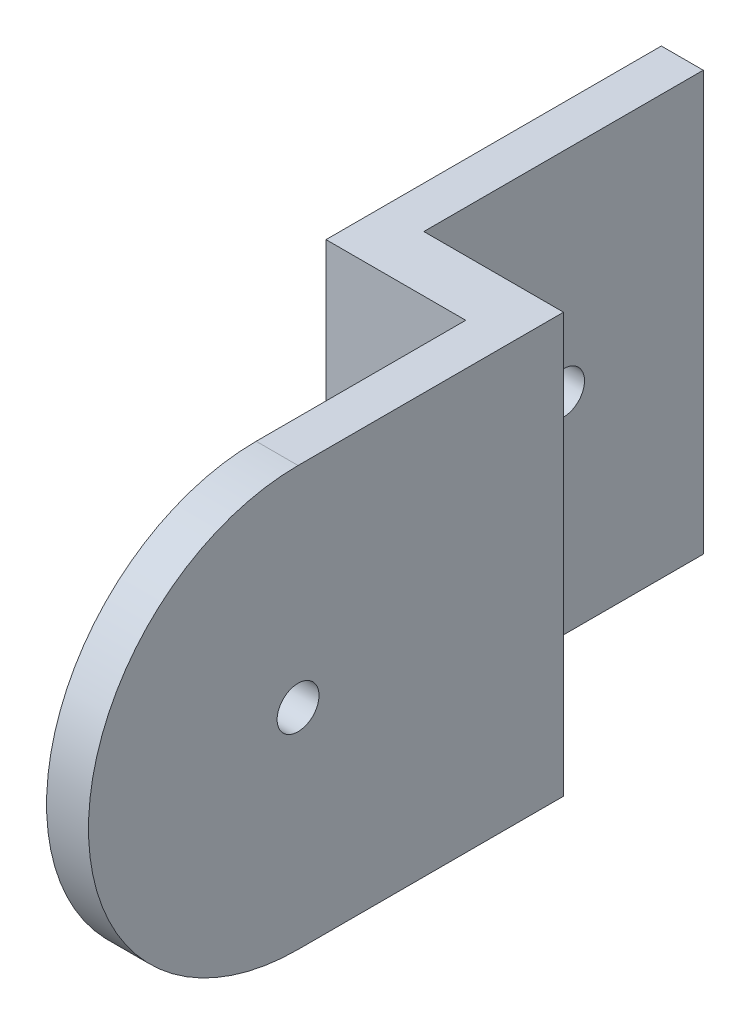
from build123d import *

# Parameters (mm, degrees)
SKETCH_1_W          = 81
SKETCH_1_H          = 30
EXTRUDE_1_DEPTH     = 4
SKETCH_2_W          = 3
SKETCH_2_H          = 30
EXTRUDE_2_DEPTH     = 20
CUT_EXTRUDE_1_REACH = 90.662
SKETCH_3_R          = 1.5
SKETCH_4_W          = 3
SKETCH_4_H          = 30
EXTRUDE_3_DEPTH     = 30
CUT_EXTRUDE_2_REACH = 86.244
CUT_EXTRUDE_3_REACH = 86.244
SKETCH_8_R          = 1.5
SKETCH_9_W          = 68
SKETCH_9_H          = 54
CUT_EXTRUDE_4_DEPTH = 30


with BuildPart() as part:
    # 草图1 → 凸台-拉伸1 (new body)
    with BuildSketch(Plane.XY):
        with Locations((40.5, -15)):
            Rectangle(SKETCH_1_W, SKETCH_1_H)
    extrude(amount=EXTRUDE_1_DEPTH)

    # 草图2 → 凸台-拉伸2 (add)
    with BuildSketch(Plane(origin=(0, 0, 0), x_dir=(-1, 0, 0), z_dir=(0, 0, -1))):
        with Locations((-1.5, -15)):
            Rectangle(SKETCH_2_W, SKETCH_2_H)
        with Locations((-79.5, -15)):
            Rectangle(SKETCH_2_W, SKETCH_2_H)
    extrude(amount=EXTRUDE_2_DEPTH)

    # 切除-拉伸1: up to this face of the body (flat: up to its plane)
    cut_extrude_1_end = Plane(part.part.faces().sort_by_distance((81, -15, -8))[0])
    # 草图3 → 切除-拉伸1 (cut, up to the picked face)
    with BuildSketch(Plane.ZY, mode=Mode.PRIVATE) as cut_extrude_1_sk1:
        with Locations((-10, -15)):
            Circle(SKETCH_3_R)
    cut_extrude_1_tool1 = split(extrude(cut_extrude_1_sk1.sketch, amount=-CUT_EXTRUDE_1_REACH, mode=Mode.PRIVATE), bisect_by=cut_extrude_1_end, keep=Keep.BOTH, mode=Mode.PRIVATE)
    add(cut_extrude_1_tool1.solids().sort_by(Axis((0, -15, -10), (1, 0, 0)))[0], mode=Mode.SUBTRACT)

    # 草图4 → 凸台-拉伸3 (add)
    with BuildSketch(Plane.XY.offset(4)):
        with Locations((11.5, -15)):
            Rectangle(SKETCH_4_W, SKETCH_4_H)
        with Locations((69.5, -15)):
            Rectangle(SKETCH_4_W, SKETCH_4_H)
    extrude(amount=EXTRUDE_3_DEPTH)

    # 切除-拉伸2: up to this face of the body (flat: up to its plane)
    cut_extrude_2_end = Plane(part.part.faces().sort_by_distance((71, -15, 19))[0])
    # 草图7 → 切除-拉伸2 (cut, up to the picked face)
    with BuildSketch(Plane.ZY.offset(-10), mode=Mode.PRIVATE) as cut_extrude_2_sk1:
        with BuildLine():
            Line((34, 0), (19, 0))
            ThreePointArc((19, 0), (29.606601718, -4.393398282), (34, -15))
            Line((34, -15), (34, 0))
        make_face()
    cut_extrude_2_tool1 = split(extrude(cut_extrude_2_sk1.sketch, amount=-CUT_EXTRUDE_2_REACH, mode=Mode.PRIVATE), bisect_by=cut_extrude_2_end, keep=Keep.BOTH, mode=Mode.PRIVATE)
    # 草图7 → 切除-拉伸2 (cut, up to the picked face)
    with BuildSketch(Plane.ZY.offset(-10), mode=Mode.PRIVATE) as cut_extrude_2_sk2:
        with BuildLine():
            ThreePointArc((34, -15), (29.606601718, -25.606601718), (19, -30))
            Line((19, -30), (34, -30))
            Line((34, -30), (34, -15))
        make_face()
    cut_extrude_2_tool2 = split(extrude(cut_extrude_2_sk2.sketch, amount=-CUT_EXTRUDE_2_REACH, mode=Mode.PRIVATE), bisect_by=cut_extrude_2_end, keep=Keep.BOTH, mode=Mode.PRIVATE)
    add(cut_extrude_2_tool1.solids().sort_by(Axis((10, -3.350519, 30.649481), (1, 0, 0)))[0], mode=Mode.SUBTRACT)
    add(cut_extrude_2_tool2.solids().sort_by(Axis((10, -26.649481, 30.649481), (1, 0, 0)))[0], mode=Mode.SUBTRACT)

    # 切除-拉伸3: up to this face of the body (flat: up to its plane)
    cut_extrude_3_end = Plane(part.part.faces().sort_by_distance((71, -15, 17.599752116))[0])
    # 草图8 → 切除-拉伸3 (cut, up to the picked face)
    with BuildSketch(Plane.ZY.offset(-10), mode=Mode.PRIVATE) as cut_extrude_3_sk1:
        with Locations((19, -15)):
            Circle(SKETCH_8_R)
    cut_extrude_3_tool1 = split(extrude(cut_extrude_3_sk1.sketch, amount=-CUT_EXTRUDE_3_REACH, mode=Mode.PRIVATE), bisect_by=cut_extrude_3_end, keep=Keep.BOTH, mode=Mode.PRIVATE)
    add(cut_extrude_3_tool1.solids().sort_by(Axis((10, -15, 19), (1, 0, 0)))[0], mode=Mode.SUBTRACT)

    # 草图9 → 切除-拉伸4 (cut)
    with BuildSketch(Plane.XZ.offset(30)):
        with Locations((47, 7)):
            Rectangle(SKETCH_9_W, SKETCH_9_H)
    extrude(amount=-CUT_EXTRUDE_4_DEPTH, mode=Mode.SUBTRACT)


solid = part.part
